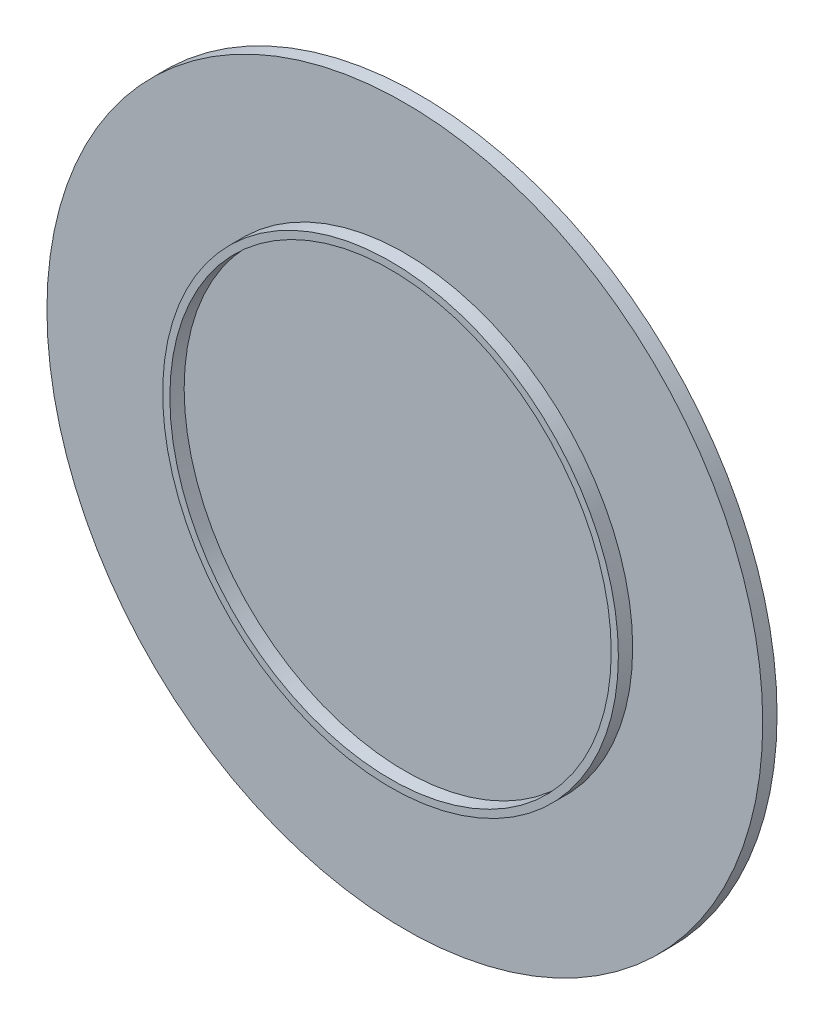
from build123d import *

# Parameters (mm, degrees)
ESQUISSE2_R        = 159.1549431
ESQUISSE2_R_2      = 154.1549431
EXTRU_MINCE1_DEPTH = 10
ESQUISSE3_R        = 250
BOSS_EXTRU_1_DEPTH = 10


with BuildPart() as part:
    # Esquisse2 → Extru.-Mince1 (new body)
    with BuildSketch(Plane.XY):
        Circle(ESQUISSE2_R)
        Circle(ESQUISSE2_R_2, mode=Mode.SUBTRACT)
    extrude(amount=EXTRU_MINCE1_DEPTH)

    # Esquisse3 → Boss.-Extru.1 (add)
    with BuildSketch(Plane.XY):
        Circle(ESQUISSE3_R)
    extrude(amount=-BOSS_EXTRU_1_DEPTH)


solid = part.part
